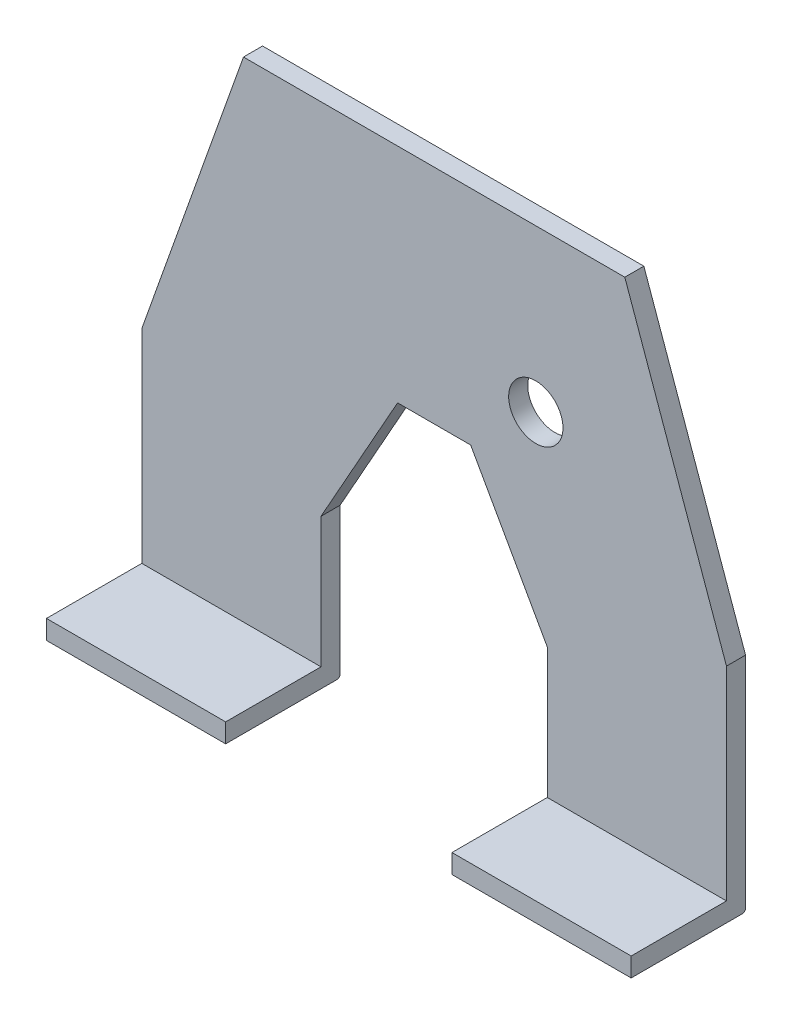
from build123d import *

# Parameters (mm, degrees)
CROQUIS1_R              = 4.271780476
SALIENTE_EXTRUIR1_DEPTH = 3
CROQUIS2_W              = 28.196158727
CROQUIS2_H              = 3
SALIENTE_EXTRUIR2_DEPTH = 18
REDONDEO2_R             = 0.5


with BuildPart() as part:
    # Croquis1 → Saliente-Extruir1 (new body)
    with BuildSketch(Plane.XY):
        Polygon((-46, -40), (-46, -5), (-30, 40), (30, 40), (46, -5), (46, -40), (17.803841273, -40), (17.803841273, -16.484284277), (5.75, 5), (-5.75, 5), (-17.803841273, -16.484284277), (-17.803841273, -40), align=None)
        with Locations((16, 14.6)):
            Circle(CROQUIS1_R, mode=Mode.SUBTRACT)
    extrude(amount=SALIENTE_EXTRUIR1_DEPTH)

    # Croquis2 → Saliente-Extruir2 (add)
    with BuildSketch(Plane(origin=(0, 0, 0), x_dir=(-1, 0, 0), z_dir=(0, 0, -1))):
        with Locations((-31.901920637, -38.5)):
            Rectangle(CROQUIS2_W, CROQUIS2_H)
        with Locations((31.901920637, -38.5)):
            Rectangle(CROQUIS2_W, CROQUIS2_H)
    extrude(amount=-SALIENTE_EXTRUIR2_DEPTH)

    # Redondeo2
    redondeo2_edges = [part.edges().sort_by_distance(p)[0] for p in [
        (31.901920636, -40, 0),
        (-31.901920636, -40, 0),
    ]]
    fillet(redondeo2_edges, radius=REDONDEO2_R)


solid = part.part
